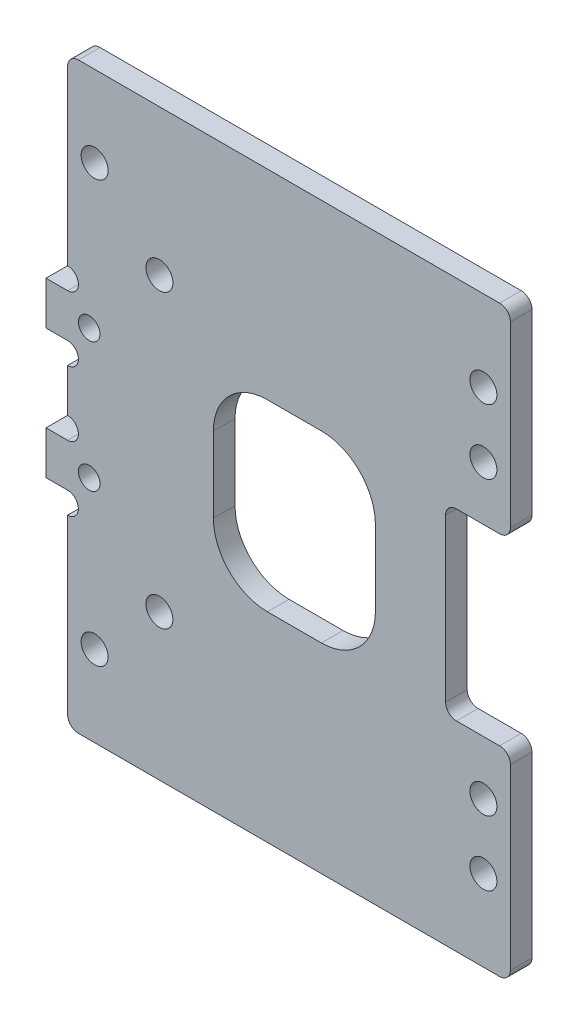
from build123d import *

# Parameters (mm, degrees)
SKETCH_1_R      = 1.25
SKETCH_1_R_2    = 1
EXTRUDE_1_DEPTH = 2


with BuildPart() as part:
    # 草圖1 → 填料-伸長1 (new body)
    with BuildSketch(Plane.XY):
        with BuildLine():
            Line((25.714690816, 4.04468624), (25.714690816, -0.95531376))
            Line((25.714690816, -0.95531376), (25.714690816, -12.45531376))
            ThreePointArc((25.714690816, -12.45531376), (25.421797597, -13.162420542), (24.714690816, -13.45531376))
            Line((24.714690816, -13.45531376), (-14.285309184, -13.45531376))
            ThreePointArc((-14.285309184, -13.45531376), (-14.992415965, -13.162420542), (-15.285309184, -12.45531376))
            Line((-15.285309184, -12.45531376), (-15.285309184, 3.54468624))
            ThreePointArc((-15.285309184, 3.54468624), (-14.285309184, 4.54468624), (-15.285309184, 5.54468624))
            Line((-15.285309184, 5.54468624), (-17.285309184, 5.54468624))
            Line((-17.285309184, 5.54468624), (-17.285309184, 9.54468624))
            Line((-17.285309184, 9.54468624), (-15.285309184, 9.54468624))
            ThreePointArc((-15.285309184, 9.54468624), (-14.285309184, 10.54468624), (-15.285309184, 11.54468624))
            Line((-15.285309184, 11.54468624), (-15.285309184, 15.54468624))
            ThreePointArc((-15.285309184, 15.54468624), (-14.285309184, 16.54468624), (-15.285309184, 17.54468624))
            Line((-15.285309184, 17.54468624), (-17.285309184, 17.54468624))
            Line((-17.285309184, 17.54468624), (-17.285309184, 21.54468624))
            Line((-17.285309184, 21.54468624), (-15.285309184, 21.54468624))
            ThreePointArc((-15.285309184, 21.54468624), (-14.285309184, 22.54468624), (-15.285309184, 23.54468624))
            Line((-15.285309184, 23.54468624), (-15.285309184, 39.54468624))
            ThreePointArc((-15.285309184, 39.54468624), (-14.992415965, 40.251793021), (-14.285309184, 40.54468624))
            Line((-14.285309184, 40.54468624), (24.714690816, 40.54468624))
            ThreePointArc((24.714690816, 40.54468624), (25.421797597, 40.251793021), (25.714690816, 39.54468624))
            Line((25.714690816, 39.54468624), (25.714690816, 28.54468624))
            Line((25.714690816, 28.54468624), (25.714690816, 23.04468624))
            ThreePointArc((25.714690816, 23.04468624), (25.421797597, 22.337579458), (24.714690816, 22.04468624))
            Line((24.714690816, 22.04468624), (20.714690816, 22.04468624))
            ThreePointArc((20.714690816, 22.04468624), (20.007584035, 21.751793021), (19.714690816, 21.04468624))
            Line((19.714690816, 21.04468624), (19.714690816, 6.04468624))
            ThreePointArc((19.714690816, 6.04468624), (20.007584035, 5.337579458), (20.714690816, 5.04468624))
            Line((20.714690816, 5.04468624), (24.714690816, 5.04468624))
            ThreePointArc((24.714690816, 5.04468624), (25.421797597, 4.751793021), (25.714690816, 4.04468624))
        make_face()
        with Locations((-6.785309184, 27.04468624)):
            Circle(SKETCH_1_R, mode=Mode.SUBTRACT)
        with Locations((23.214690816, 27.04468624)):
            Circle(SKETCH_1_R, mode=Mode.SUBTRACT)
        with Locations((-6.785309184, 0.04468624)):
            Circle(SKETCH_1_R, mode=Mode.SUBTRACT)
        with Locations((23.214690816, 0.04468624)):
            Circle(SKETCH_1_R, mode=Mode.SUBTRACT)
        with Locations((-12.785309184, 33.04468624)):
            Circle(SKETCH_1_R, mode=Mode.SUBTRACT)
        with Locations((23.214690816, 33.04468624)):
            Circle(SKETCH_1_R, mode=Mode.SUBTRACT)
        with Locations(Location((23.214690816, -5.95531376, 0), (0, 0, 180))):
            Circle(SKETCH_1_R, mode=Mode.SUBTRACT)
        with Locations(Location((-12.785309184, -5.95531376, 0), (0, 0, 180))):
            Circle(SKETCH_1_R, mode=Mode.SUBTRACT)
        with Locations((-13.285309184, 19.54468624)):
            Circle(SKETCH_1_R_2, mode=Mode.SUBTRACT)
        with Locations((-13.285309184, 7.54468624)):
            Circle(SKETCH_1_R_2, mode=Mode.SUBTRACT)
        with BuildLine():
            Line((3.214690816, 22.04468624), (8.214690816, 22.04468624))
            ThreePointArc((8.214690816, 22.04468624), (11.750224722, 20.580220146), (13.214690816, 17.04468624))
            Line((13.214690816, 17.04468624), (13.214690816, 10.04468624))
            ThreePointArc((13.214690816, 10.04468624), (11.750224722, 6.509152334), (8.214690816, 5.04468624))
            Line((8.214690816, 5.04468624), (3.214690816, 5.04468624))
            ThreePointArc((3.214690816, 5.04468624), (-0.32084309, 6.509152334), (-1.785309184, 10.04468624))
            Line((-1.785309184, 10.04468624), (-1.785309184, 17.04468624))
            ThreePointArc((-1.785309184, 17.04468624), (-0.32084309, 20.580220146), (3.214690816, 22.04468624))
        make_face(mode=Mode.SUBTRACT)
    extrude(amount=EXTRUDE_1_DEPTH)


solid = part.part
